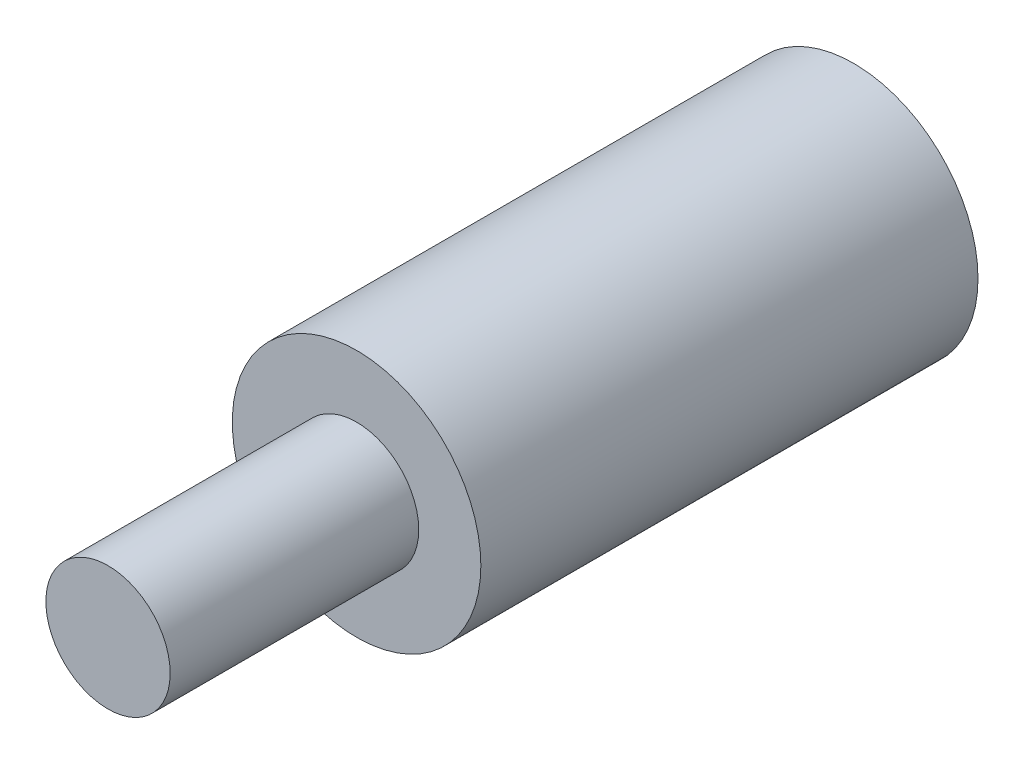
from build123d import *

# Parameters (mm, degrees)
SKETCH_1_R      = 5
EXTRUDE_1_DEPTH = 20
SKETCH_1_3_R    = 10
EXTRUDE_2_DEPTH = 40


with BuildPart() as part:
    # 草图1 → 凸台-拉伸1 (new body)
    with BuildSketch(Plane.XY):
        Circle(SKETCH_1_R)
    extrude(amount=EXTRUDE_1_DEPTH)

    # 草图1<3> → 凸台-拉伸2 (add)
    with BuildSketch(Plane.XY):
        Circle(SKETCH_1_3_R)
    extrude(amount=-EXTRUDE_2_DEPTH)


solid = part.part
